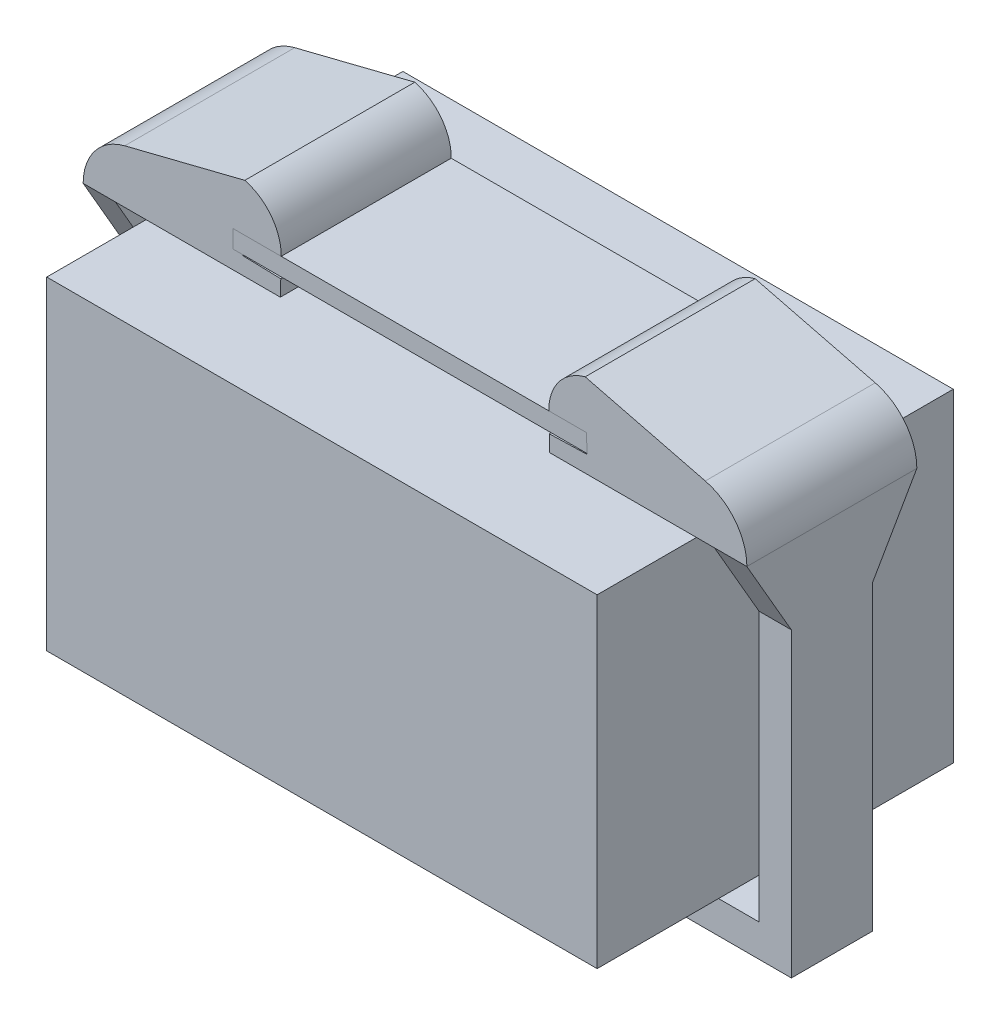
from build123d import *

# Parameters (mm, degrees)
SKETCH1_W                = 45
SKETCH1_H                = 21
BOSS_EXTRUDE1_DEPTH      = 2.2
SKETCH2_W                = 68
SKETCH2_H                = 44
BOSS_EXTRUDE2_DEPTH      = 40
BOSS_EXTRUDE3_DEPTH      = 5
BOSS_EXTRUDE3_DEPTH_BACK = 5
SKETCH4_R                = 2.25
BOSS_EXTRUDE4_DEPTH      = 10.5
BOSS_EXTRUDE4_DEPTH_BACK = 10.5
BOSS_EXTRUDE5_START      = -4
BOSS_EXTRUDE5_DEPTH      = 4


with BuildPart() as part:
    # Sketch1 → Boss-Extrude1 (new body)
    with BuildSketch(Plane(origin=(0, 0, 0), x_dir=(1, 0, 0), z_dir=(0, 1, 0))):
        Rectangle(SKETCH1_W, SKETCH1_H)
    extrude(amount=BOSS_EXTRUDE1_DEPTH)


with BuildPart() as body_2:
    # Sketch2 → Boss-Extrude2 (new body)
    with BuildSketch(Plane(origin=(0, -3, 0), x_dir=(1, 0, 0), z_dir=(0, 1, 0))):
        Rectangle(SKETCH2_W, SKETCH2_H)
    extrude(amount=-BOSS_EXTRUDE2_DEPTH)


with BuildPart() as body_3:
    # Sketch4 → Boss-Extrude3 (new, two sides: drawn at the far end of the back side and taken through both)
    with BuildSketch(Plane.XY.offset(-BOSS_EXTRUDE3_DEPTH_BACK)):
        with BuildLine():
            Line((37, -45), (-37, -45))
            Line((-37, -45), (-37, -2.2240504))
            Line((-37, -2.2240504), (-41, -2.2240504))
            Line((-41, -2.2240504), (-41, -49))
            Line((-41, -49), (-25.25, -49))
            ThreePointArc((-25.25, -49), (0, -54.5), (25.25, -49))
            Line((25.25, -49), (41, -49))
            Line((41, -49), (41, -2.2240504))
            Line((41, -2.2240504), (37, -2.2240504))
            Line((37, -2.2240504), (37, -45))
        make_face()
        with Locations((0, -49.75)):
            Circle(SKETCH4_R, mode=Mode.SUBTRACT)
    extrude(amount=BOSS_EXTRUDE3_DEPTH + BOSS_EXTRUDE3_DEPTH_BACK)

    # Sketch4<4> → Boss-Extrude4 (add, two sides: drawn at the far end of the back side and taken through both)
    with BuildSketch(Plane.XY.offset(-BOSS_EXTRUDE4_DEPTH_BACK)):
        with BuildLine():
            Line((21.023852366, 8.08576998), (35.862584958, 4.361924258))
            ThreePointArc((35.862584958, 4.361924258), (39.563749625, 1.952314512), (41, -2.2240504))
            Line((41, -2.2240504), (37, -2.2240504))
            Line((37, -2.2240504), (16.637886535, -2.2240504))
            Line((16.637886535, -2.2240504), (16.584785654, -0.224755451))
            Line((16.584785654, -0.224755451), (21.25, -0.100848275))
            Line((21.25, -0.100848275), (21.188912452, 2.199151725))
            Line((21.188912452, 2.199151725), (16.523852366, 2.069566723))
            ThreePointArc((16.523852366, 2.069566723), (17.726706241, 5.86091276), (21.023852366, 8.08576998))
        make_face()
        with BuildLine():
            Line((-21.023852366, 8.08576998), (-35.862584958, 4.361924258))
            ThreePointArc((-35.862584958, 4.361924258), (-39.563749625, 1.952314512), (-41, -2.2240504))
            Line((-41, -2.2240504), (-37, -2.2240504))
            Line((-37, -2.2240504), (-16.637886535, -2.2240504))
            Line((-16.637886535, -2.2240504), (-16.584785654, -0.224755451))
            Line((-16.584785654, -0.224755451), (-21.25, -0.100848275))
            Line((-21.25, -0.100848275), (-21.188912452, 2.199151725))
            Line((-21.188912452, 2.199151725), (-16.523852366, 2.069566723))
            ThreePointArc((-16.523852366, 2.069566723), (-17.726706241, 5.86091276), (-21.023852366, 8.08576998))
        make_face()
    extrude(amount=BOSS_EXTRUDE4_DEPTH + BOSS_EXTRUDE4_DEPTH_BACK)

    # Sketch6 → Boss-Extrude5 (add)
    with BuildSketch(Plane(origin=(41, 0, 0), x_dir=(0, 0, -1), z_dir=(1, 0, 0)).offset(BOSS_EXTRUDE5_START)):
        Polygon((10.5, -2.2240504), (5, -11.750329842), (5, -2.2240504), align=None)
        Polygon((-5, -11.750329842), (-5, -2.2240504), (-10.5, -2.2240504), align=None)
    boss_extrude5 = extrude(amount=BOSS_EXTRUDE5_DEPTH)

    # Mirror1: Boss-Extrude5 across plane
    add(boss_extrude5.mirror(Plane(origin=(0, 0, 0), x_dir=(0, 0, 1), z_dir=(1, 0, 0))))


solid = Compound([part.part, body_2.part, body_3.part])
